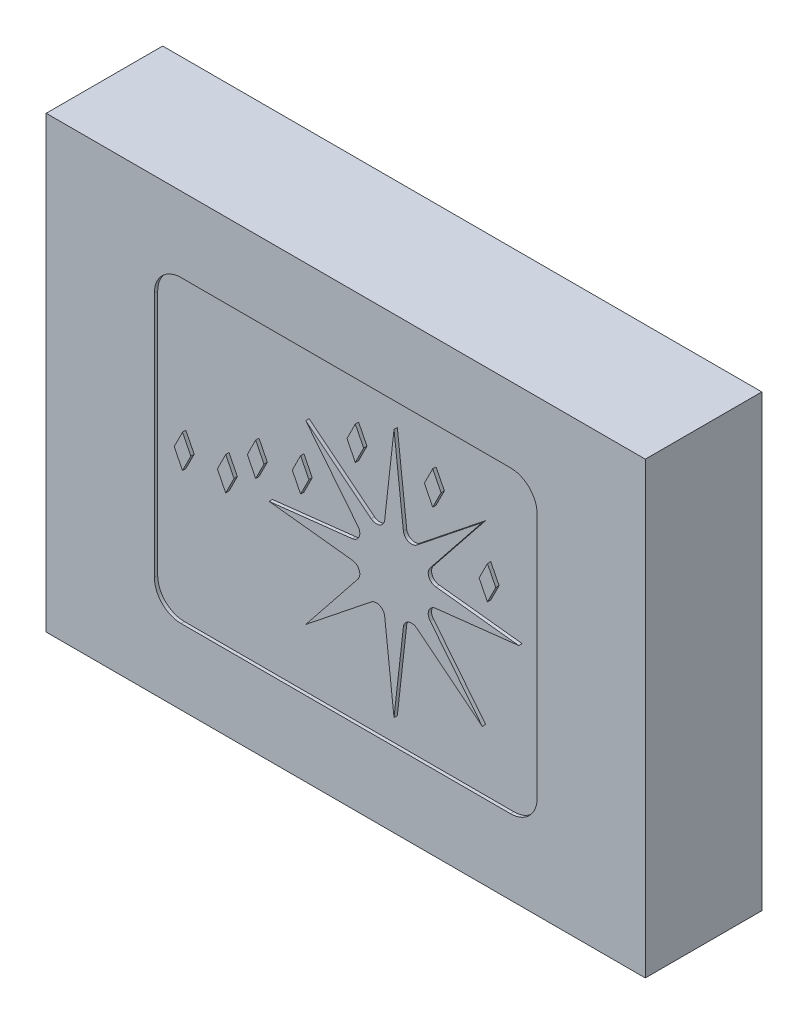
from build123d import *

# Parameters (mm, degrees)
SKETCH1_W           = 36
SKETCH1_H           = 27
BOSS_EXTRUDE1_DEPTH = 7
CUT_EXTRUDE1_DEPTH  = 0.2
BOSS_EXTRUDE2_DEPTH = 0.2
BOSS_EXTRUDE3_DEPTH = 0.2


with BuildPart() as part:
    # Sketch1 → Boss-Extrude1 (new body)
    with BuildSketch(Plane.XY):
        Rectangle(SKETCH1_W, SKETCH1_H)
    extrude(amount=BOSS_EXTRUDE1_DEPTH)

    # Sketch2 → Cut-Extrude1 (cut)
    with BuildSketch(Plane.XY.offset(7)):
        with BuildLine():
            Line((-9.9, -9), (9.9, -9))
            ThreePointArc((9.9, -9), (11.03137085, -8.53137085), (11.5, -7.4))
            Line((11.5, -7.4), (11.5, 7.4))
            ThreePointArc((11.5, 7.4), (11.03137085, 8.53137085), (9.9, 9))
            Line((9.9, 9), (-9.9, 9))
            ThreePointArc((-9.9, 9), (-11.03137085, 8.53137085), (-11.5, 7.4))
            Line((-11.5, 7.4), (-11.5, -7.4))
            ThreePointArc((-11.5, -7.4), (-11.03137085, -8.53137085), (-9.9, -9))
        make_face()
    extrude(amount=-CUT_EXTRUDE1_DEPTH, mode=Mode.SUBTRACT)

    # Sketch3 → Boss-Extrude2 (add)
    with BuildSketch(Plane.XY.offset(6.8)):
        with BuildLine():
            Line((2.9, 7.5), (3.461670446, 2.49974195))
            ThreePointArc((3.461670446, 2.49974195), (3.767203859, 2.093615319), (4.270423503, 2.164745466))
            Line((4.270423503, 2.164745466), (8.203300859, 5.303300859))
            Line((8.203300859, 5.303300859), (5.064745466, 1.370423503))
            ThreePointArc((5.064745466, 1.370423503), (4.993615319, 0.867203859), (5.39974195, 0.561670446))
            Line((5.39974195, 0.561670446), (10.4, 0))
            Line((10.4, 0), (5.39974195, -0.561670446))
            ThreePointArc((5.39974195, -0.561670446), (4.993615319, -0.867203859), (5.064745466, -1.370423503))
            Line((5.064745466, -1.370423503), (8.203300859, -5.303300859))
            Line((8.203300859, -5.303300859), (4.270423503, -2.164745466))
            ThreePointArc((4.270423503, -2.164745466), (3.767203859, -2.093615319), (3.461670446, -2.49974195))
            Line((3.461670446, -2.49974195), (2.9, -7.5))
            Line((2.9, -7.5), (2.338329554, -2.49974195))
            ThreePointArc((2.338329554, -2.49974195), (2.032796141, -2.093615319), (1.529576497, -2.164745466))
            Line((1.529576497, -2.164745466), (-2.403300859, -5.303300859))
            Line((-2.403300859, -5.303300859), (0.735254534, -1.370423503))
            ThreePointArc((0.735254534, -1.370423503), (0.806384681, -0.867203859), (0.40025805, -0.561670446))
            Line((0.40025805, -0.561670446), (-4.6, 0))
            Line((-4.6, 0), (0.40025805, 0.561670446))
            ThreePointArc((0.40025805, 0.561670446), (0.806384681, 0.867203859), (0.735254534, 1.370423503))
            Line((0.735254534, 1.370423503), (-2.403300859, 5.303300859))
            Line((-2.403300859, 5.303300859), (1.529576497, 2.164745466))
            ThreePointArc((1.529576497, 2.164745466), (2.032796141, 2.093615319), (2.338329554, 2.49974195))
            Line((2.338329554, 2.49974195), (2.9, 7.5))
        make_face()
    extrude(amount=BOSS_EXTRUDE2_DEPTH)

    # Sketch5 → Boss-Extrude3 (add)
    with BuildSketch(Plane.XY.offset(6.8)):
        Polygon((-5.413360388, 2.785130003), (-4.913360388, 1.785130003), (-5.413360388, 0.785130003), (-5.913360388, 1.785130003), align=None)
        Polygon((8.513360388, 3.325130003), (9.013360388, 2.325130003), (8.513360388, 1.325130003), (8.013360388, 2.325130003), align=None)
        Polygon((4.725130003, 5.613360388), (5.225130003, 6.613360388), (5.725130003, 5.613360388), (5.225130003, 4.613360388), align=None)
        Polygon((0.574869997, 6.613360388), (1.074869997, 5.613360388), (0.574869997, 4.613360388), (0.074869997, 5.613360388), align=None)
        Polygon((-2.713360388, 3.325130003), (-2.213360388, 2.325130003), (-2.713360388, 1.325130003), (-3.213360388, 2.325130003), align=None)
        Polygon((-7.213360388, 1.135887753), (-6.713360388, 0.135887753), (-7.213360388, -0.864112247), (-7.713360388, 0.135887753), align=None)
        Polygon((-9.808959232, 1), (-9.308959232, 0), (-9.808959232, -1), (-10.308959232, 0), align=None)
    extrude(amount=BOSS_EXTRUDE3_DEPTH)


solid = part.part
